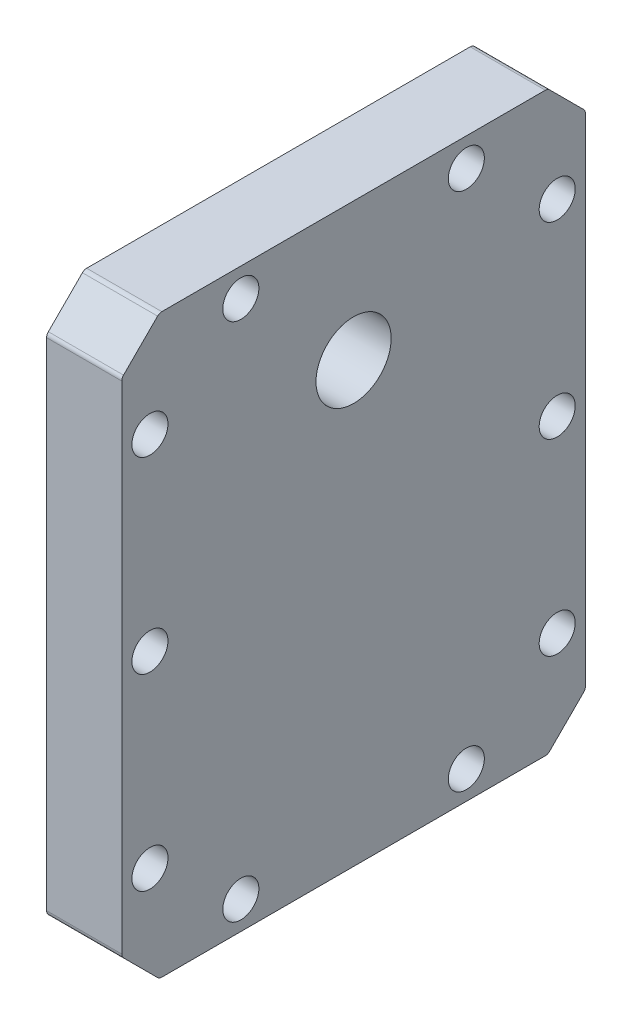
from build123d import *

# Parameters (mm, degrees)
SKETCH1_W             = 48.6918
SKETCH1_H             = 39.1668
SKETCH1_R             = 4.7625
SKETCH1_R_2           = 3.175
BOSS_EXTRUDE1_DEPTH   = 7.62
CHAMFER1_SIZE         = 3.175
SKETCH3_W             = 39.1668
SKETCH3_H             = 29.6418
CUT_EXTRUDE2_DEPTH    = 1.27
F_4_CLEARANCE_HOLE1_D = 3.048
SKETCH7_R             = 4.415840843
SKETCH7_R_2           = 3.175
SKETCH7_R_3           = 1.5875
BOSS_EXTRUDE2_DEPTH   = 1.27
SKETCH15_R            = 6.0325
BOSS_EXTRUDE7_DEPTH   = 7.62
FILLET3_R             = 6.985
FILLET4_R             = 0.508


with BuildPart() as part:
    # Sketch1 → Boss-Extrude1 (new body)
    with BuildSketch(Plane.YZ):
        with Locations((-3.96875, 0)):
            Rectangle(SKETCH1_W, SKETCH1_H)
        with Locations(Location((-8.73125, 0, 0), (0, 0, 90))):
            Circle(SKETCH1_R, mode=Mode.SUBTRACT)
        with Locations(Location((8.73125, 0, 0), (0, 0, 90))):
            Circle(SKETCH1_R_2, mode=Mode.SUBTRACT)
    extrude(amount=BOSS_EXTRUDE1_DEPTH)

    # Chamfer1
    chamfer1_edges = [part.edges().sort_by_distance(p)[0] for p in [
        (3.81, 20.37715, -19.5834),
        (3.81, -28.31465, -19.5834),
        (3.81, -28.31465, 19.5834),
        (3.81, 20.37715, 19.5834),
    ]]
    chamfer(chamfer1_edges, length=CHAMFER1_SIZE)

    # Sketch3 → Cut-Extrude2 (cut)
    with BuildSketch(Plane(origin=(0, 0, 0), x_dir=(0, -1, 0), z_dir=(-1, 0, 0))):
        Polygon((-18.254252448, -22.1234), (26.191752448, -22.1234), (30.85465, -17.460502448), (30.85465, 17.460502448), (26.191752448, 22.1234), (-18.254252448, 22.1234), (-22.91715, 17.460502448), (-22.91715, -17.460502448), align=None)
        with Locations((3.96875, 0)):
            Rectangle(SKETCH3_W, SKETCH3_H, mode=Mode.SUBTRACT)
    extrude(amount=-CUT_EXTRUDE2_DEPTH, mode=Mode.SUBTRACT)

    # #4 Clearance Hole1 (through all)
    with Locations(Plane(origin=(1.27, 0, 0), x_dir=(0, -1, 0), z_dir=(-1, 0, 0))):
        with Locations((-17.9959, 9.525), (-11.90625, 17.20215), (3.96875, 17.20215), (19.84375, 17.20215), (25.9334, 9.525), (25.9334, -9.525), (19.84375, -17.20215), (3.96875, -17.20215), (-11.90625, -17.20215), (-17.9959, -9.525)):
            Hole(F_4_CLEARANCE_HOLE1_D / 2)

    # Sketch7 → Boss-Extrude2 (add)
    # profile 1 of 2: a face of its own
    with BuildSketch(Plane(origin=(0, 0, 0), x_dir=(0, -1, 0), z_dir=(-1, 0, 0))):
        with Locations((-8.73125, 0)):
            Circle(SKETCH7_R)
        with Locations(Location((-8.73125, 0, 0), (0, 0, 90))):
            Circle(SKETCH7_R_2, mode=Mode.SUBTRACT)
    # profile 2 of 2: a face of its own
    with BuildSketch(Plane(origin=(0, 0, 0), x_dir=(0, -1, 0), z_dir=(-1, 0, 0))):
        with Locations(Location((-8.73125, 0, 0), (0, 0, 90))):
            Circle(SKETCH7_R_2)
        with Locations(Location((-8.73125, 0, 0), (0, 0, 90))):
            Circle(SKETCH7_R_3, mode=Mode.SUBTRACT)
    extrude(amount=-BOSS_EXTRUDE2_DEPTH)

    # Sketch15 → Boss-Extrude7 (add)
    with BuildSketch(Plane.YZ.offset(7.62)):
        with Locations((-8.73125, 0)):
            Circle(SKETCH15_R)
    extrude(amount=-BOSS_EXTRUDE7_DEPTH)

    # Fillet3
    fillet3_edges = [part.edges().sort_by_distance(p)[0] for p in [
        (0.635, 15.61465, 14.8209),
        (0.635, -23.55215, 14.8209),
        (0.635, -23.55215, -14.8209),
        (0.635, 15.61465, -14.8209),
    ]]
    fillet(fillet3_edges, radius=FILLET3_R)

    # Fillet4
    fillet4_edges = [part.edges().sort_by_distance(p)[0] for p in [
        (4.445, -25.13965, -19.5834),
        (4.445, -28.31465, 16.4084),
        (4.445, 20.37715, -16.4084),
        (4.445, 17.20215, 19.5834),
        (4.445, -25.13965, 19.5834),
        (4.445, 20.37715, 16.4084),
        (4.445, 17.20215, -19.5834),
        (4.445, -28.31465, -16.4084),
    ]]
    fillet(fillet4_edges, radius=FILLET4_R)


solid = part.part
